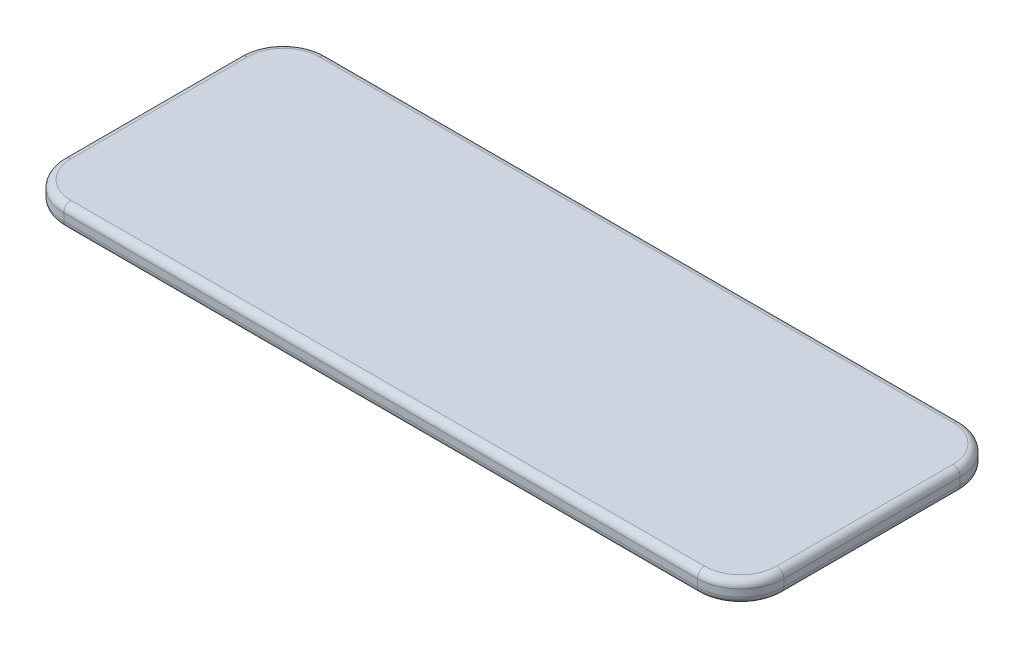
from build123d import *

# Parameters (mm, degrees)
BOSS_EXTRUDE1_DEPTH = 30
FILLET1_R           = 10


with BuildPart() as part:
    # Sketch1 → Boss-Extrude1 (new body)
    with BuildSketch(Plane(origin=(0, 0, 0), x_dir=(1, 0, 0), z_dir=(0, 1, 0))):
        with BuildLine():
            Line((-60, 0), (-940, 0))
            ThreePointArc((-940, 0), (-982.426406871, 17.573593129), (-1000, 60))
            Line((-1000, 60), (-1000, 305))
            ThreePointArc((-1000, 305), (-982.426406871, 347.426406871), (-940, 365))
            Line((-940, 365), (-60, 365))
            ThreePointArc((-60, 365), (-17.573593129, 347.426406871), (0, 305))
            Line((0, 305), (0, 60))
            ThreePointArc((0, 60), (-17.573593129, 17.573593129), (-60, 0))
        make_face()
    extrude(amount=BOSS_EXTRUDE1_DEPTH)

    # Fillet1
    fillet1_edges = [part.edges().sort_by_distance(p)[0] for p in [
        (-1000, 0, -182.5),
        (-982.426406871, 0, -347.426406871),
        (-500, 0, -365),
        (-17.573593129, 0, -347.426406871),
        (-982.426406871, 30, -347.426406871),
        (-1000, 30, -182.5),
        (-982.426406871, 30, -17.573593129),
        (-500, 30, 0),
        (-17.573593129, 30, -17.573593129),
        (0, 30, -182.5),
        (-17.573593129, 30, -347.426406871),
        (0, 0, -182.5),
        (-500, 30, -365),
        (-17.573593129, 0, -17.573593129),
        (-500, 0, 0),
        (-982.426406871, 0, -17.573593129),
    ]]
    fillet(fillet1_edges, radius=FILLET1_R)


solid = part.part
